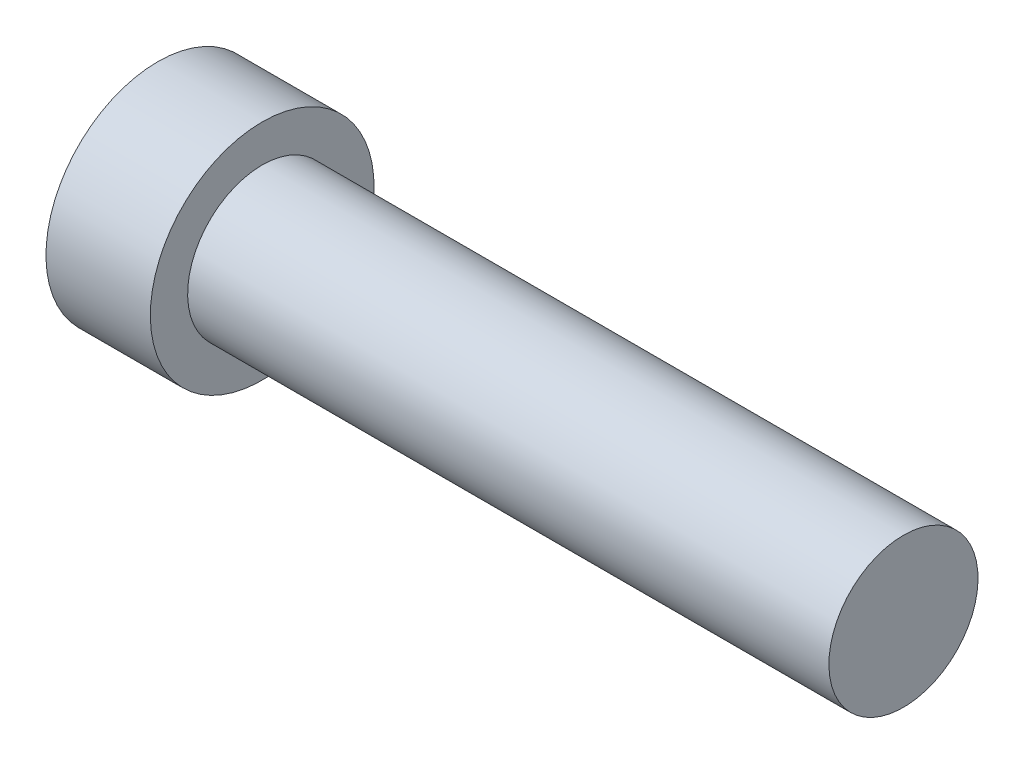
from build123d import *

# Parameters (mm, degrees)
SKETCH1_W   = 7
SKETCH1_H   = 7.5
SKETCH1_W_2 = 43
SKETCH1_H_2 = 5


with BuildPart() as part:
    # Sketch1 → Revolve1 (revolve)
    with BuildSketch(Plane.XY):
        with Locations((3.5, 3.75)):
            Rectangle(SKETCH1_W, SKETCH1_H)
        with Locations((28.5, 2.5)):
            Rectangle(SKETCH1_W_2, SKETCH1_H_2)
    revolve(axis=Axis((50, 0, 0), (-1, 0, 0)))


solid = part.part
